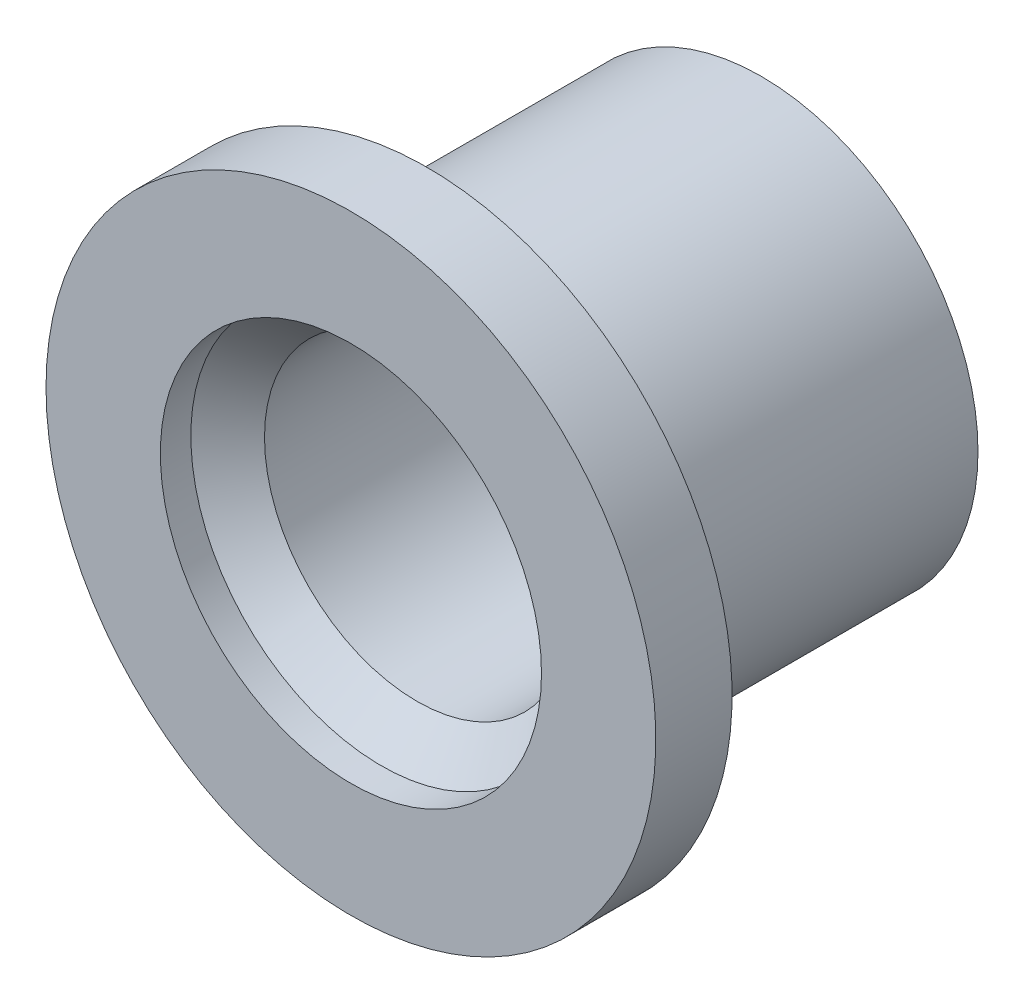
from build123d import *

# Parameters (mm, degrees)
SKETCH1_R           = 5.08
SKETCH1_R_2         = 2.54
BOSS_EXTRUDE1_DEPTH = 0.762
CHAMFER2_SIZE       = 0.635
CHAMFER2_SIZE2      = 0.59214708
SKETCH3_R           = 5.08
SKETCH3_R_2         = 3.175
BOSS_EXTRUDE3_DEPTH = 0.508
BOSS_EXTRUDE4_START = 5.56768
SKETCH4_R           = 3.609397664
SKETCH4_R_2         = 2.54
BOSS_EXTRUDE4_DEPTH = 5.56768


with BuildPart() as part:
    # Sketch1 → Boss-Extrude1 (new body)
    with BuildSketch(Plane.XY):
        with Locations(Location((0, 0, 0), (0, 0, 180))):
            Circle(SKETCH1_R)
        with Locations(Location((0, 0, 0), (0, 0, 180))):
            Circle(SKETCH1_R_2, mode=Mode.SUBTRACT)
    extrude(amount=BOSS_EXTRUDE1_DEPTH)

    # Chamfer2
    chamfer2_edges = [part.edges().sort_by_distance(p)[0] for p in [
        (2.54, 0, 0.762),
    ]]
    chamfer2_side = [part.faces().sort_by_distance(p)[0] for p in [
        (4.936315902, 0, 0.762),
    ]]
    chamfer(chamfer2_edges, length=CHAMFER2_SIZE, length2=CHAMFER2_SIZE2, reference=chamfer2_side[0])

    # Sketch3 → Boss-Extrude3 (add)
    with BuildSketch(Plane.XY.offset(0.762)):
        with Locations(Location((0, 0, 0), (0, 0, 180))):
            Circle(SKETCH3_R)
        Circle(SKETCH3_R_2, mode=Mode.SUBTRACT)
    extrude(amount=BOSS_EXTRUDE3_DEPTH)

    # Sketch4 → Boss-Extrude4 (add)
    with BuildSketch(Plane(origin=(0, 0, 0), x_dir=(-1, 0, 0), z_dir=(0, 0, -1)).offset(BOSS_EXTRUDE4_START)):
        with Locations(Location((0, 0, 0), (0, 0, 180))):
            Circle(SKETCH4_R)
        Circle(SKETCH4_R_2, mode=Mode.SUBTRACT)
    extrude(amount=-BOSS_EXTRUDE4_DEPTH)


solid = part.part
